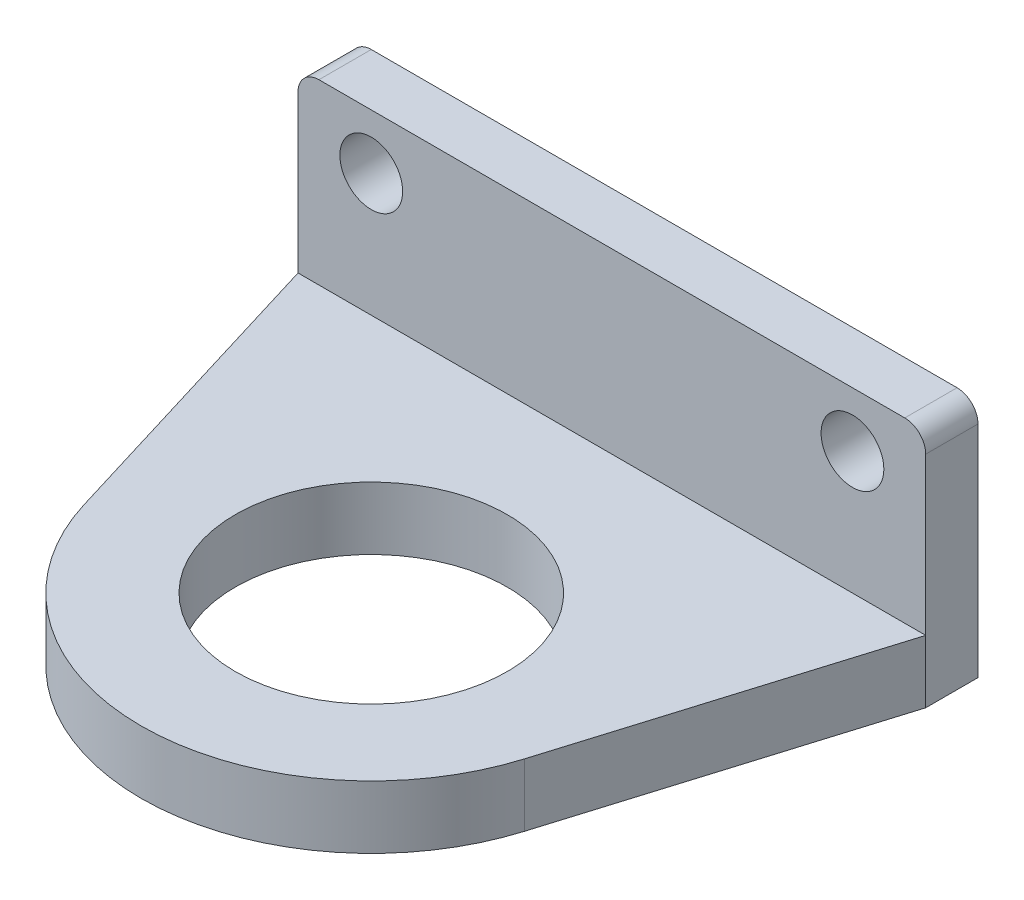
from build123d import *

# Parameters (mm, degrees)
SKETCH1_R           = 6.5
BOSS_EXTRUDE1_DEPTH = 3
SKETCH2_W           = 30
SKETCH2_H           = 2.5
BOSS_EXTRUDE2_DEPTH = 8.5
FILLET1_R           = 1
SKETCH3_R           = 1.5
CUT_EXTRUDE1_DEPTH  = 8.5


with BuildPart() as part:
    # Sketch1 → Boss-Extrude1 (new body)
    with BuildSketch(Plane(origin=(0, 0, 0), x_dir=(1, 0, 0), z_dir=(0, 1, 0))):
        with BuildLine():
            Line((-15, 0), (15, 0))
            Line((15, 0), (15, -2.5))
            Line((15, -2.5), (10.523048028, -17.203975688))
            ThreePointArc((10.523048028, -17.203975688), (0, -25), (-10.523048028, -17.203975688))
            Line((-10.523048028, -17.203975688), (-15, -2.5))
            Line((-15, -2.5), (-15, 0))
        make_face()
        with Locations(Location((0, -14, 0), (0, 0, 270))):
            Circle(SKETCH1_R, mode=Mode.SUBTRACT)
    extrude(amount=-BOSS_EXTRUDE1_DEPTH)

    # Sketch2 → Boss-Extrude2 (add)
    with BuildSketch(Plane(origin=(0, 0, 0), x_dir=(1, 0, 0), z_dir=(0, 1, 0))):
        with Locations((0, -1.25)):
            Rectangle(SKETCH2_W, SKETCH2_H)
    extrude(amount=BOSS_EXTRUDE2_DEPTH)

    # Fillet1
    fillet1_edges = [part.edges().sort_by_distance(p)[0] for p in [
        (-15, 8.5, 1.25),
        (15, 8.5, 1.25),
    ]]
    fillet(fillet1_edges, radius=FILLET1_R)

    # Sketch3 → Cut-Extrude1 (cut)
    with BuildSketch(Plane.XY.offset(2.5)):
        with Locations((11.5, 5.874642398)):
            Circle(SKETCH3_R)
    cut_extrude1 = extrude(amount=-CUT_EXTRUDE1_DEPTH, mode=Mode.SUBTRACT)

    # Mirror1: Cut-Extrude1 across plane
    add(cut_extrude1.mirror(Plane(origin=(0, 0, 0), x_dir=(0, 0, 1), z_dir=(1, 0, 0))), mode=Mode.SUBTRACT)


solid = part.part
